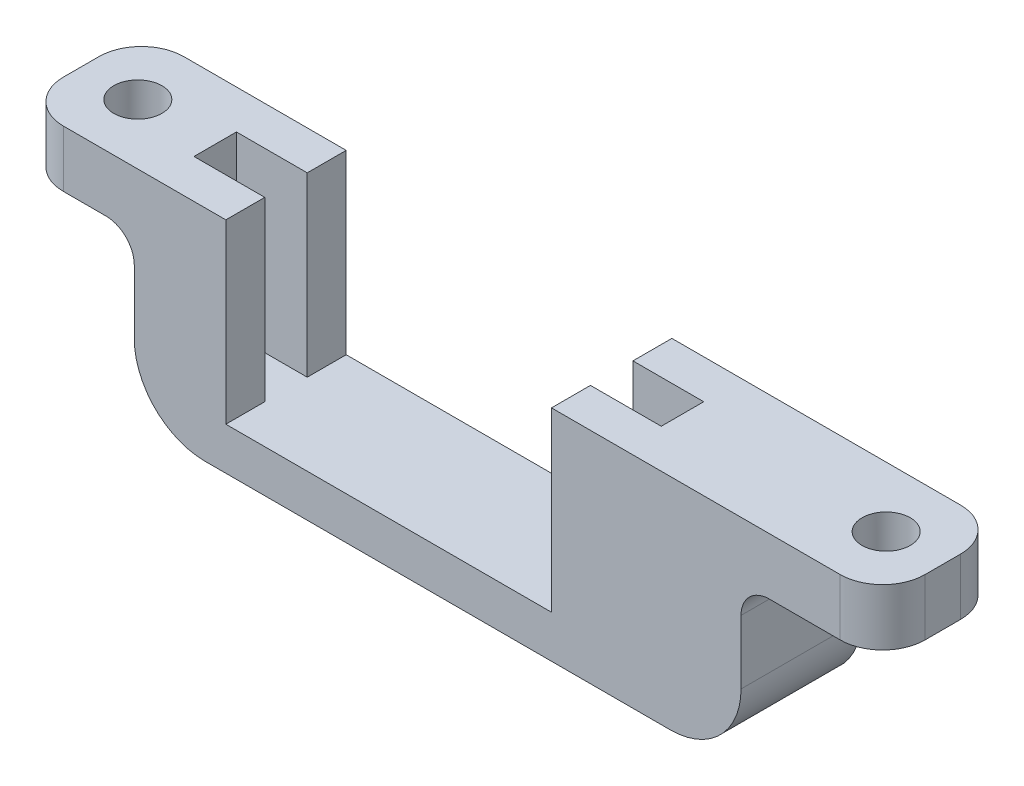
from build123d import *

# Parameters (mm, degrees)
SKETCH1_W           = 60.85
SKETCH1_H           = 8.5
BOSS_EXTRUDE1_DEPTH = 15.5
SKETCH4_R           = 1.7
CUT_EXTRUDE3_DEPTH  = 35.409201168
SKETCH2_W           = 5
SKETCH2_H           = 3
CUT_EXTRUDE1_DEPTH  = 12.5
SKETCH3_W           = 8
SKETCH3_H           = 8.5
SKETCH3_W_2         = 10
CUT_EXTRUDE2_DEPTH  = 11.5
FILLET1_R           = 2
FILLET2_R           = 3
FILLET3_R           = 5


with BuildPart() as part:
    # Sketch1 → Boss-Extrude1 (new body)
    with BuildSketch(Plane(origin=(0, 0, 0), x_dir=(1, 0, 0), z_dir=(0, 1, 0))):
        Rectangle(SKETCH1_W, SKETCH1_H)
    extrude(amount=BOSS_EXTRUDE1_DEPTH)

    # Sketch4 → Cut-Extrude3 (cut, through all)
    with BuildSketch(Plane(origin=(0, 15.5, 0), x_dir=(1, 0, 0), z_dir=(0, 1, 0))):
        with Locations(Location((-26.425, 0, 0), (0, 0, 270))):
            Circle(SKETCH4_R)
        with Locations(Location((26.425, 0, 0), (0, 0, 90))):
            Circle(SKETCH4_R)
    extrude(amount=-CUT_EXTRUDE3_DEPTH, mode=Mode.SUBTRACT)

    # Sketch2 → Cut-Extrude1 (cut)
    with BuildSketch(Plane(origin=(0, 15.5, 0), x_dir=(1, 0, 0), z_dir=(0, 1, 0))):
        Polygon((-15.96, -1.5), (-15.96, -4.25), (7.04, -4.25), (7.04, -1.5), (7.04, 1.5), (7.04, 4.25), (-15.96, 4.25), (-15.96, 1.5), align=None)
        with Locations((-18.46, 0)):
            Rectangle(SKETCH2_W, SKETCH2_H)
        with Locations((9.54, 0)):
            Rectangle(SKETCH2_W, SKETCH2_H)
    extrude(amount=-CUT_EXTRUDE1_DEPTH, mode=Mode.SUBTRACT)

    # Sketch3 → Cut-Extrude2 (cut)
    with BuildSketch(Plane.XZ):
        with Locations((-26.425, 0)):
            Rectangle(SKETCH3_W, SKETCH3_H)
        with Locations((25.425, 0)):
            Rectangle(SKETCH3_W_2, SKETCH3_H)
    extrude(amount=-CUT_EXTRUDE2_DEPTH, mode=Mode.SUBTRACT)

    # Fillet1
    fillet1_edges = [part.edges().sort_by_distance(p)[0] for p in [
        (-22.425, 11.5, 0),
        (20.425, 11.5, 0),
    ]]
    fillet(fillet1_edges, radius=FILLET1_R)

    # Fillet2
    fillet2_edges = [part.edges().sort_by_distance(p)[0] for p in [
        (30.425, 13.5, 4.25),
        (-30.425, 13.5, 4.25),
        (-30.425, 13.5, -4.25),
        (30.425, 13.5, -4.25),
    ]]
    fillet(fillet2_edges, radius=FILLET2_R)

    # Fillet3
    fillet3_edges = [part.edges().sort_by_distance(p)[0] for p in [
        (-22.425, 0, 0),
        (20.425, 0, 0),
    ]]
    fillet(fillet3_edges, radius=FILLET3_R)


solid = part.part
